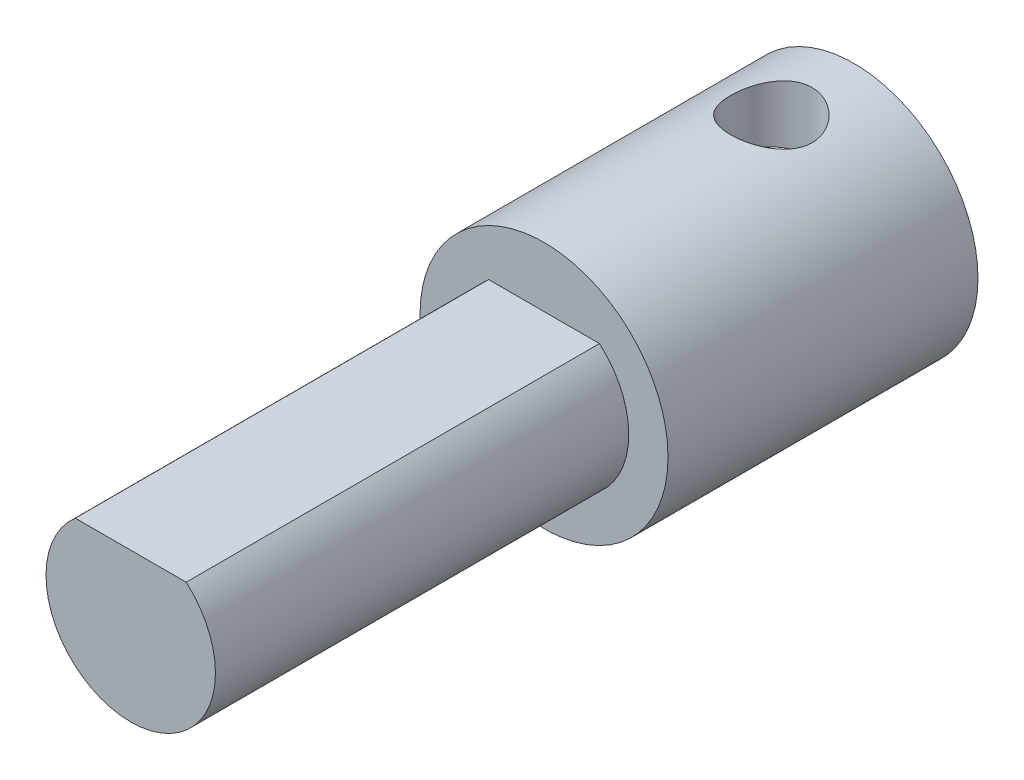
from build123d import *

# Parameters (mm, degrees)
SKETCH1_R                = 6
BOSS_EXTRUDE1_DEPTH      = 15
BOSS_EXTRUDE2_DEPTH      = 20
BOSS_EXTRUDE2_DEPTH_BACK = 5
BOSS_EXTRUDE2_START      = 15
CUT_EXTRUDE1_REACH       = 38.014
CUT_EXTRUDE1_END_RADIUS  = 6
SKETCH3_R                = 1.975


with BuildPart() as part:
    # Sketch1 → Boss-Extrude1 (new body)
    with BuildSketch(Plane.XY):
        Circle(SKETCH1_R)
        with BuildLine():
            Line((-2.683281573, 3.1), (2.683281573, 3.1))
            ThreePointArc((2.683281573, 3.1), (0, -4.1), (-2.683281573, 3.1))
        make_face(mode=Mode.SUBTRACT)
    extrude(amount=BOSS_EXTRUDE1_DEPTH)

    # Sketch1<3> → Boss-Extrude2 (add, two sides: drawn at the far end of the back side and taken through both)
    with BuildSketch(Plane.XY.offset(BOSS_EXTRUDE2_START - BOSS_EXTRUDE2_DEPTH_BACK)):
        with BuildLine():
            Line((2.683281573, 3.1), (-2.683281573, 3.1))
            ThreePointArc((-2.683281573, 3.1), (-1.704192705, -3.729038378), (4.1, 0))
            ThreePointArc((4.1, 0), (3.729038378, 1.704192705), (2.683281573, 3.1))
        make_face()
    extrude(amount=BOSS_EXTRUDE2_DEPTH + BOSS_EXTRUDE2_DEPTH_BACK)

    # Cut-Extrude1: up to this cylinder (the profile starts inside it)
    cut_extrude1_end = Plane(origin=(0, 0, 4), z_dir=(0, 0, -1)) * Cylinder(CUT_EXTRUDE1_END_RADIUS, 89.028, mode=Mode.PRIVATE)
    # Sketch3 → Cut-Extrude1 (cut, up to the surface)
    with BuildSketch(Plane(origin=(0, 0, 0), x_dir=(1, 0, 0), z_dir=(0, 1, 0)), mode=Mode.PRIVATE) as cut_extrude1_sk1:
        with Locations(Location((0, -4, 0), (0, 0, 90))):
            Circle(SKETCH3_R)
    cut_extrude1_tool1 = extrude(cut_extrude1_sk1.sketch, amount=CUT_EXTRUDE1_REACH, mode=Mode.PRIVATE) & cut_extrude1_end
    add(cut_extrude1_tool1.solids().sort_by_distance((0, 0, 4))[0], mode=Mode.SUBTRACT)


solid = part.part
